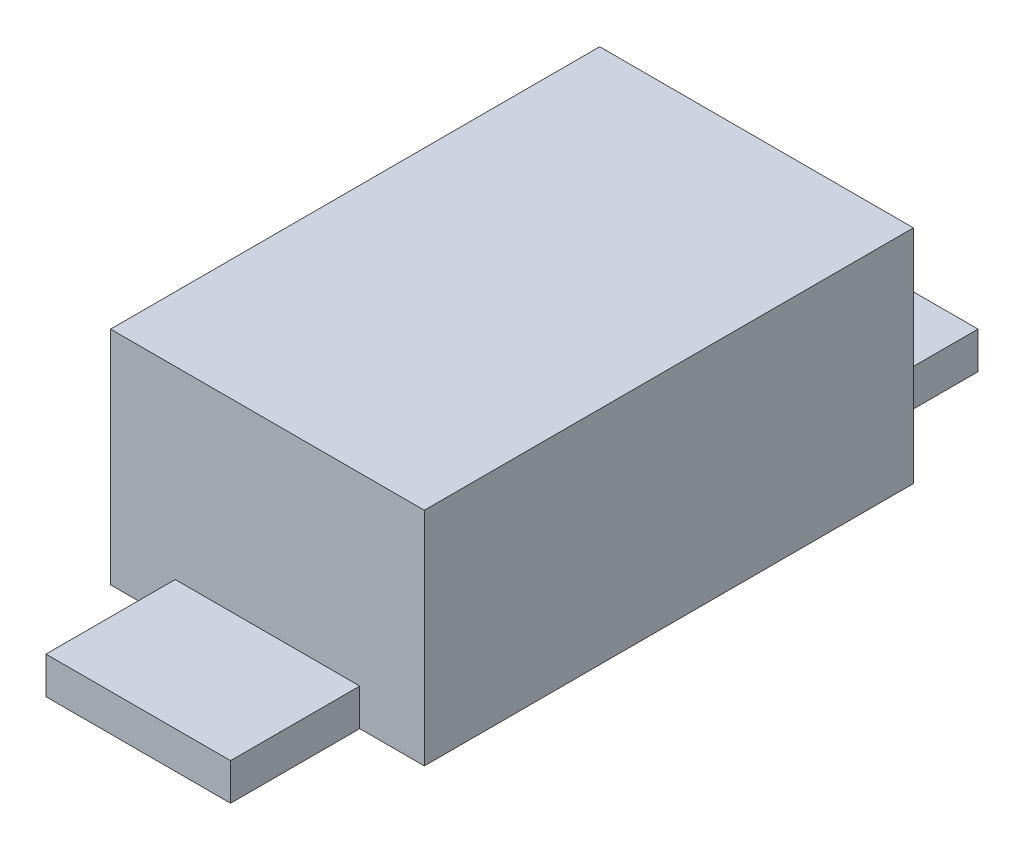
from build123d import *

# Parameters (mm, degrees)
SCHIZZO1_W                   = 1.7
SCHIZZO1_H                   = 2.65
ESTRUSIONE_ESTRUSIONE1_DEPTH = 1.2
SCHIZZO2_W                   = 1
SCHIZZO2_H                   = 0.2
ESTRUSIONE_ESTRUSIONE2_DEPTH = 0.7
SCHIZZO4_W                   = 1
SCHIZZO4_H                   = 0.2
ESTRUSIONE_ESTRUSIONE4_DEPTH = 0.7


with BuildPart() as part:
    # Schizzo1 → Estrusione-Estrusione1 (new body)
    with BuildSketch(Plane(origin=(0, 0, 0), x_dir=(1, 0, 0), z_dir=(0, 1, 0))):
        with Locations((-6.048243597, -8.447511762)):
            Rectangle(SCHIZZO1_W, SCHIZZO1_H)
    extrude(amount=ESTRUSIONE_ESTRUSIONE1_DEPTH)

    # Schizzo2 → Estrusione-Estrusione2 (add)
    with BuildSketch(Plane.XY.offset(9.772511762)):
        with Locations((-6.048243597, 0.1)):
            Rectangle(SCHIZZO2_W, SCHIZZO2_H)
    extrude(amount=ESTRUSIONE_ESTRUSIONE2_DEPTH)

    # Schizzo4 → Estrusione-Estrusione4 (add)
    with BuildSketch(Plane(origin=(0, 0, 7.122511762), x_dir=(-1, 0, 0), z_dir=(0, 0, -1))):
        with Locations((6.048243597, 0.1)):
            Rectangle(SCHIZZO4_W, SCHIZZO4_H)
    extrude(amount=ESTRUSIONE_ESTRUSIONE4_DEPTH)


solid = part.part
